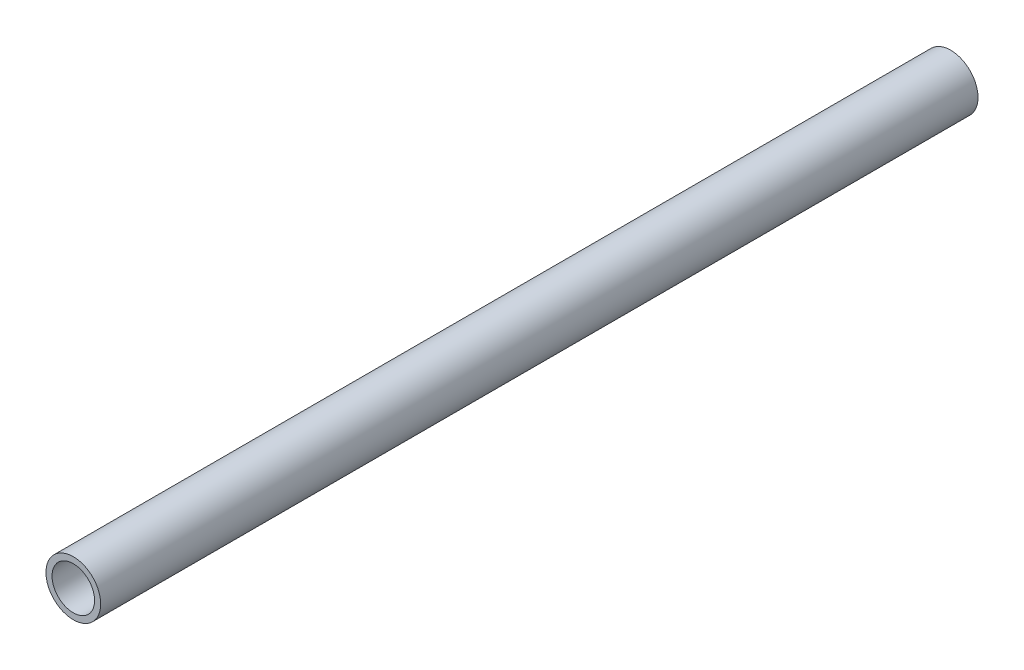
from build123d import *

# Parameters (mm, degrees)
SKETCH1_R           = 9
SKETCH1_R_2         = 7
BOSS_EXTRUDE1_DEPTH = 288.574


with BuildPart() as part:
    # Sketch1 → Boss-Extrude1 (new body)
    with BuildSketch(Plane.XY):
        Circle(SKETCH1_R)
        Circle(SKETCH1_R_2, mode=Mode.SUBTRACT)
    extrude(amount=BOSS_EXTRUDE1_DEPTH)


solid = part.part
